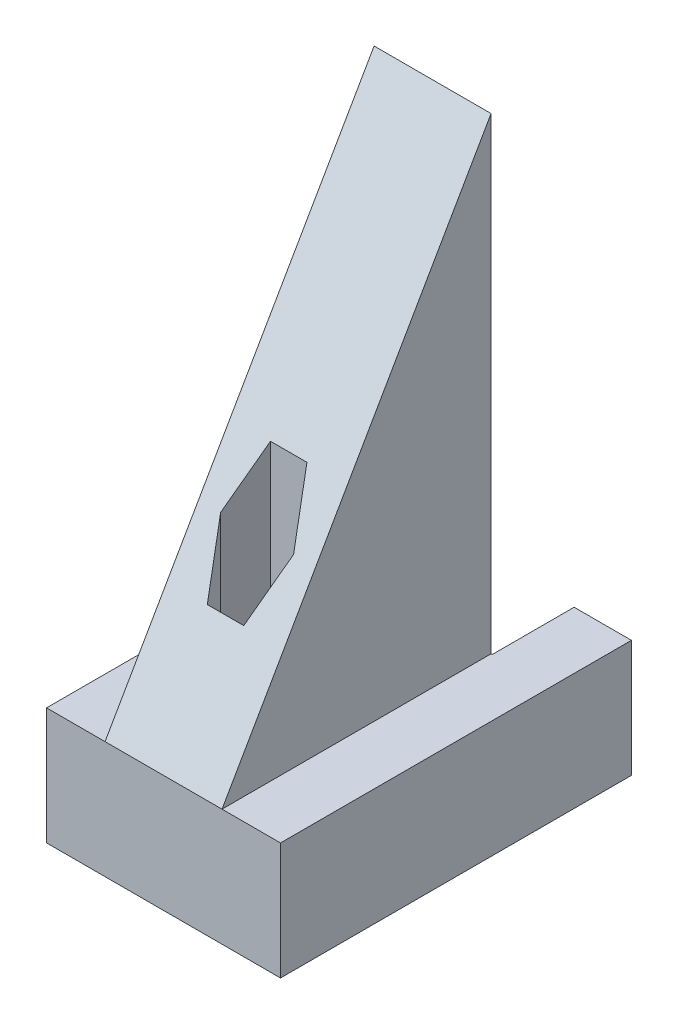
from build123d import *

# Parameters (mm, degrees)
BOSS_EXTRUDE1_DEPTH = 10
BOSS_EXTRUDE2_DEPTH = 5
CUT_EXTRUDE1_START  = 30
CUT_EXTRUDE1_DEPTH  = 25
CUT_EXTRUDE2_REACH  = 55.151
SKETCH4_R           = 1.4


with BuildPart() as part:
    # Sketch1 → Boss-Extrude1 (new body)
    with BuildSketch(Plane(origin=(0, 0, 0), x_dir=(1, 0, 0), z_dir=(0, 1, 0))):
        Polygon((-5.1, 15), (-5.1, 8), (5.1, 8), (5.1, 15), (10, 15), (10, -15), (-10, -15), (-10, 15), align=None)
    extrude(amount=BOSS_EXTRUDE1_DEPTH)

    # Sketch2 → Boss-Extrude2 (add, symmetric)
    with BuildSketch(Plane(origin=(0, 0, 0), x_dir=(0, 0, -1), z_dir=(1, 0, 0))):
        Polygon((-15, 10), (8, 50), (8, 10), align=None)
    extrude(amount=BOSS_EXTRUDE2_DEPTH, both=True)

    # Sketch3 → Cut-Extrude1 (cut)
    with BuildSketch(Plane(origin=(0, 0, 0), x_dir=(1, 0, 0), z_dir=(0, 1, 0)).offset(CUT_EXTRUDE1_START)):
        Polygon((3.117691454, -7), (1.558845727, -4.3), (-1.558845727, -4.3), (-3.117691454, -7), (-1.558845727, -9.7), (1.558845727, -9.7), align=None)
    extrude(amount=-CUT_EXTRUDE1_DEPTH, mode=Mode.SUBTRACT)

    # Sketch4 → Cut-Extrude2 (cut, up to next)
    with BuildSketch(Plane(origin=(0, 0, 0), x_dir=(1, 0, 0), z_dir=(0, 1, 0)), mode=Mode.PRIVATE) as cut_extrude2_sk1:
        with Locations(Location((0, -7, 0), (0, 0, 270))):
            Circle(SKETCH4_R)
    cut_extrude2_tool1 = extrude(cut_extrude2_sk1.sketch, amount=CUT_EXTRUDE2_REACH, mode=Mode.PRIVATE) & part.part
    add(cut_extrude2_tool1.solids().sort_by_distance((0, 0, 7))[0], mode=Mode.SUBTRACT)


solid = part.part
